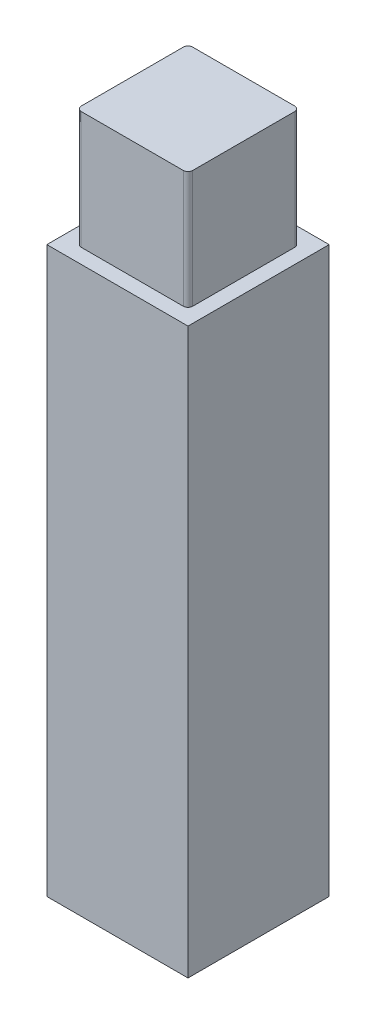
from build123d import *

# Parameters (mm, degrees)
SKETCH1_W           = 30
SKETCH1_H           = 30
BOSS_EXTRUDE1_DEPTH = 120
SKETCH2_W           = 23.7
SKETCH2_H           = 23.7
BOSS_EXTRUDE2_DEPTH = 25
SKETCH3_W           = 24
SKETCH3_H           = 24
CUT_EXTRUDE1_DEPTH  = 26
FILLET1_R           = 1


with BuildPart() as part:
    # Sketch1 → Boss-Extrude1 (new body)
    with BuildSketch(Plane(origin=(0, 0, 0), x_dir=(1, 0, 0), z_dir=(0, 1, 0))):
        Rectangle(SKETCH1_W, SKETCH1_H)
    extrude(amount=BOSS_EXTRUDE1_DEPTH)

    # Sketch2 → Boss-Extrude2 (add)
    with BuildSketch(Plane(origin=(0, 120, 0), x_dir=(1, 0, 0), z_dir=(0, 1, 0))):
        Rectangle(SKETCH2_W, SKETCH2_H)
    extrude(amount=BOSS_EXTRUDE2_DEPTH)

    # Sketch3 → Cut-Extrude1 (cut)
    with BuildSketch(Plane.XZ):
        Rectangle(SKETCH3_W, SKETCH3_H)
    extrude(amount=-CUT_EXTRUDE1_DEPTH, mode=Mode.SUBTRACT)

    # Fillet1
    fillet1_edges = [part.edges().sort_by_distance(p)[0] for p in [
        (11.85, 132.5, 11.85),
        (11.85, 132.5, -11.85),
        (-11.85, 132.5, -11.85),
        (-11.85, 132.5, 11.85),
    ]]
    fillet(fillet1_edges, radius=FILLET1_R)


solid = part.part
